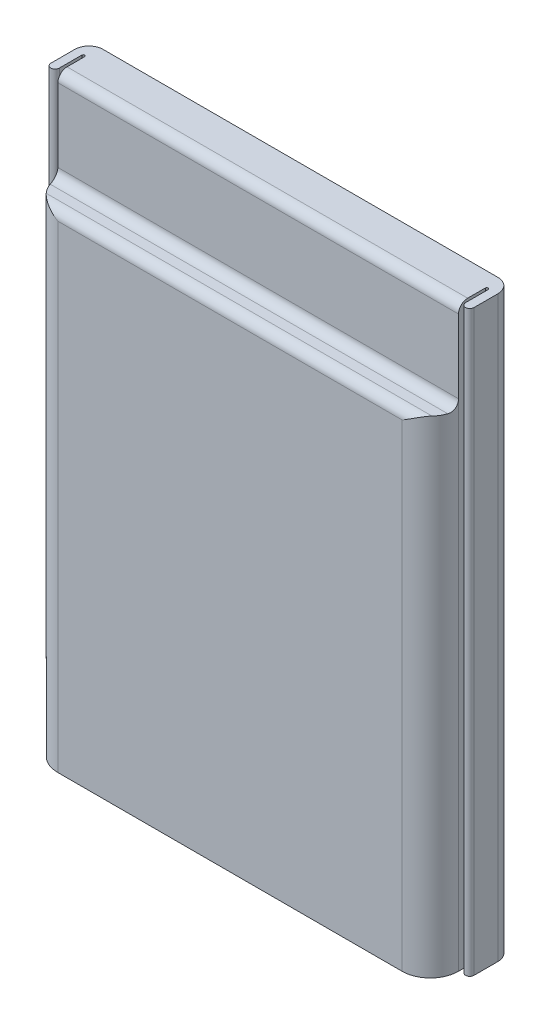
from build123d import *

# Parameters (mm, degrees)
EXTRUDE_1_DEPTH                 = 20.5
CUT_EXTRUDE_1_REACH             = 27.889
CUT_EXTRUDE_1_DIRECTION_2_REACH = 27.889


with BuildPart() as part:
    # Эскиз1 → Бобышка-Вытянуть1 (new, symmetric)
    with BuildSketch(Plane(origin=(0, 0, 0), x_dir=(1, 0, 0), z_dir=(0, 1, 0))):
        with BuildLine():
            Line((-14, 0), (14, 0))
            ThreePointArc((14, 0), (14.707106781, -0.292893219), (15, -1))
            Line((15, -1), (15, -2.7))
            ThreePointArc((15, -2.7), (14.7, -3), (14.4, -2.7))
            Line((14.4, -2.7), (14.4, -1.1))
            ThreePointArc((14.4, -1.1), (14.3, -1), (14.2, -1.1))
            Line((14.2, -1.1), (14.2, -3))
            ThreePointArc((14.2, -3), (13.614213562, -4.414213562), (12.2, -5))
            Line((12.2, -5), (-12.2, -5))
            ThreePointArc((-12.2, -5), (-13.614213562, -4.414213562), (-14.2, -3))
            Line((-14.2, -3), (-14.2, -1.1))
            ThreePointArc((-14.2, -1.1), (-14.3, -1), (-14.4, -1.1))
            Line((-14.4, -1.1), (-14.4, -2.7))
            ThreePointArc((-14.4, -2.7), (-14.7, -3), (-15, -2.7))
            Line((-15, -2.7), (-15, -1))
            ThreePointArc((-15, -1), (-14.707106781, -0.292893219), (-14, 0))
        make_face()
    extrude(amount=EXTRUDE_1_DEPTH, both=True)

    # Эскиз2 → Вырез-Вытянуть1 (cut, up to next)
    with BuildSketch(Plane(origin=(0, 0, 0), x_dir=(0, 0, -1), z_dir=(1, 0, 0)), mode=Mode.PRIVATE) as cut_extrude_1_sk1:
        with BuildLine():
            Line((-3, 19.85), (-3, 14.65))
            ThreePointArc((-3, 14.65), (-3.190380592, 14.190380592), (-3.65, 14))
            Line((-3.65, 14), (-4.35, 14))
            ThreePointArc((-4.35, 14), (-4.809619408, 13.809619408), (-5, 13.35))
            Line((-5, 13.35), (-5, 20.5))
            Line((-5, 20.5), (-2.35, 20.5))
            ThreePointArc((-2.35, 20.5), (-2.809619408, 20.309619408), (-3, 19.85))
        make_face()
    cut_extrude_1_tool1 = extrude(cut_extrude_1_sk1.sketch, amount=-CUT_EXTRUDE_1_REACH, mode=Mode.PRIVATE) & part.part
    add(cut_extrude_1_tool1.solids().sort_by_distance((0, 17.269493, 4.003909))[0], mode=Mode.SUBTRACT)

    # Эскиз2 → Вырез-Вытянуть1 direction 2 (cut, up to next)
    with BuildSketch(Plane(origin=(0, 0, 0), x_dir=(0, 0, -1), z_dir=(1, 0, 0)), mode=Mode.PRIVATE) as cut_extrude_1_direction_2_sk1:
        with BuildLine():
            Line((-3, 19.85), (-3, 14.65))
            ThreePointArc((-3, 14.65), (-3.190380592, 14.190380592), (-3.65, 14))
            Line((-3.65, 14), (-4.35, 14))
            ThreePointArc((-4.35, 14), (-4.809619408, 13.809619408), (-5, 13.35))
            Line((-5, 13.35), (-5, 20.5))
            Line((-5, 20.5), (-2.35, 20.5))
            ThreePointArc((-2.35, 20.5), (-2.809619408, 20.309619408), (-3, 19.85))
        make_face()
    cut_extrude_1_direction_2_tool1 = extrude(cut_extrude_1_direction_2_sk1.sketch, amount=CUT_EXTRUDE_1_DIRECTION_2_REACH, mode=Mode.PRIVATE) & part.part
    add(cut_extrude_1_direction_2_tool1.solids().sort_by_distance((0, 17.269493, 4.003909))[0], mode=Mode.SUBTRACT)


solid = part.part
